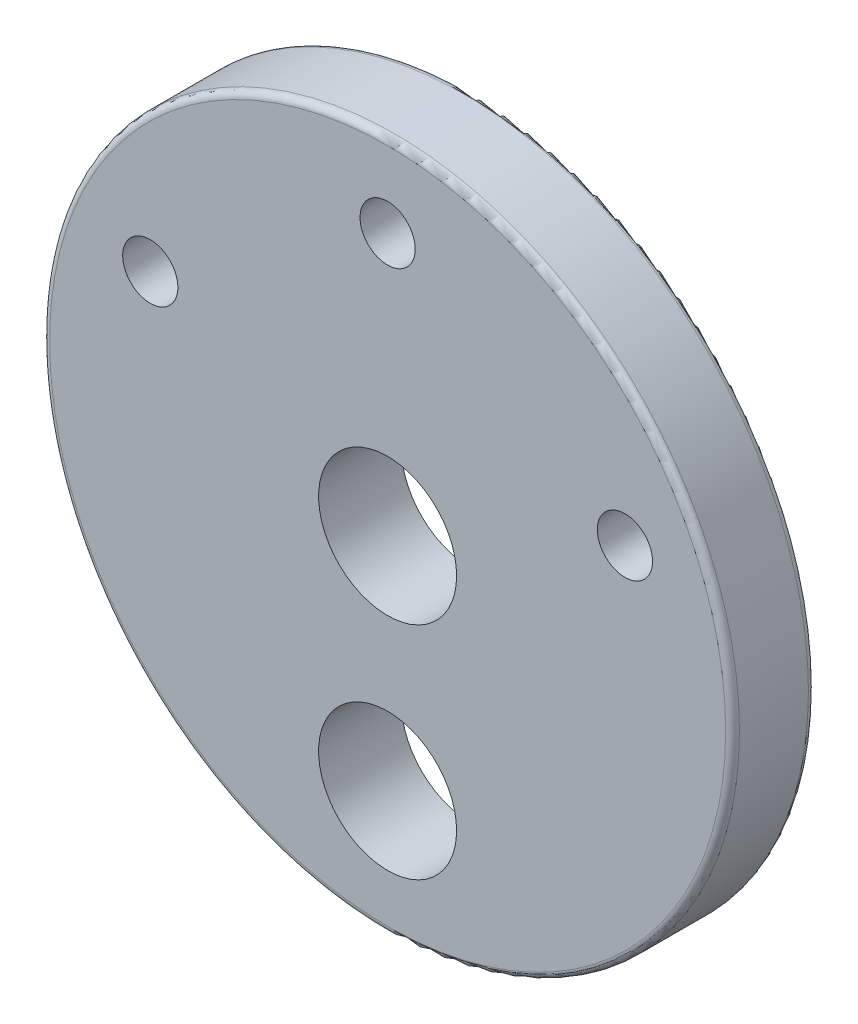
from build123d import *

# Parameters (mm, degrees)
SKETCH1_R           = 12.5
BOSS_EXTRUDE1_DEPTH = 3
SKETCH2_R           = 2.5
SKETCH2_R_2         = 1
CUT_EXTRUDE1_DEPTH  = 3
FILLET1_R           = 0.25


with BuildPart() as part:
    # Sketch1 → Boss-Extrude1 (new body)
    with BuildSketch(Plane.XY):
        Circle(SKETCH1_R)
    extrude(amount=BOSS_EXTRUDE1_DEPTH)

    # Sketch2 → Cut-Extrude1 (cut)
    with BuildSketch(Plane.XY.offset(3)):
        Circle(SKETCH2_R)
        with Locations((0, -8)):
            Circle(SKETCH2_R)
        with Locations((0, 9.5)):
            Circle(SKETCH2_R_2)
        with Locations((8.6, 4)):
            Circle(SKETCH2_R_2)
        with Locations((-8.6, 4)):
            Circle(SKETCH2_R_2)
    extrude(amount=-CUT_EXTRUDE1_DEPTH, mode=Mode.SUBTRACT)

    # Fillet1
    fillet1_edges = [part.edges().sort_by_distance(p)[0] for p in [
        (-12.5, 0, 0),
        (-12.5, 0, 3),
    ]]
    fillet(fillet1_edges, radius=FILLET1_R)


solid = part.part
